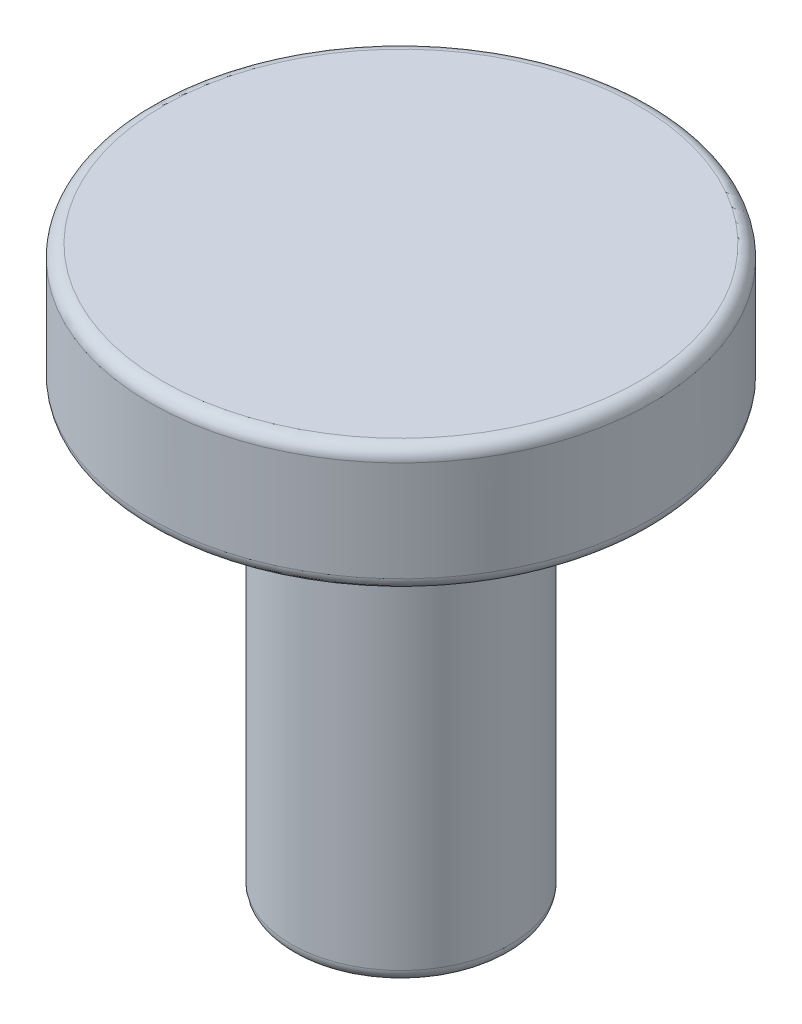
from build123d import *

# Parameters (mm, degrees)
FILLET1_R = 0.2


with BuildPart() as part:
    # Sketch1 → Revolve1 (revolve)
    with BuildSketch(Plane(origin=(0, 0, 0), x_dir=(0, 0, -1), z_dir=(1, 0, 0))):
        Polygon((0, 0), (-1.75, 0), (-1.75, 9), (2.25, 9), (2.25, 7), (0, 7), align=None)
    revolve(axis=Axis((0, 0, 1.75), (0, 1, 0)))

    # Fillet1
    fillet1_edges = [part.edges().sort_by_distance(p)[0] for p in [
        (0, 7, 5.75),
        (0, 9, 5.75),
        (0, 0, 3.5),
    ]]
    fillet(fillet1_edges, radius=FILLET1_R)


solid = part.part
